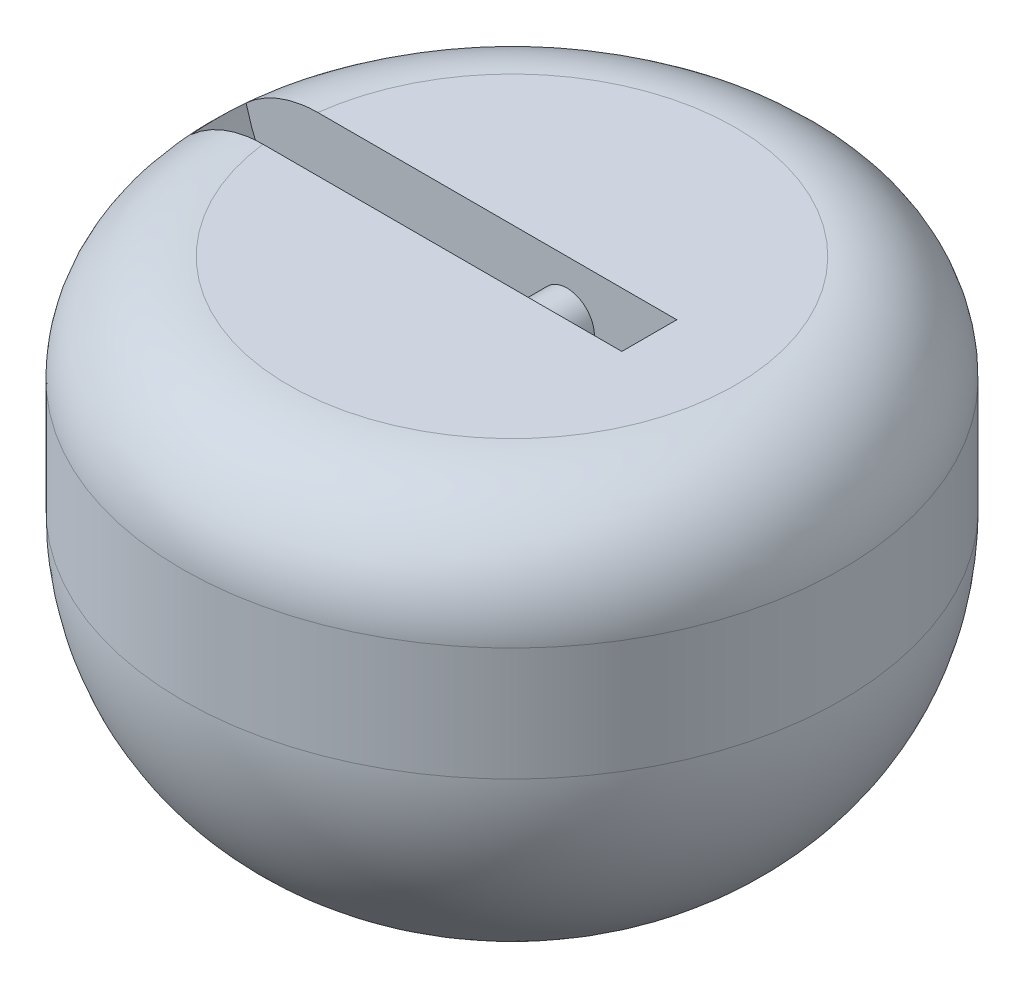
from build123d import *

# Parameters (mm, degrees)
CUT_EXTRUDE_1_DEPTH = 1
SKETCH_3_R          = 1
EXTRUDE_2_DEPTH     = 2
SCALE_1_SCALE       = 2


with BuildPart() as part:
    # 草图1 → 旋转1 (revolve)
    with BuildSketch(Plane.XY, mode=Mode.PRIVATE) as revolve_1_sk:
        with BuildLine():
            Line((0, 0), (8.130902005, 0))
            ThreePointArc((8.130902005, 0), (10.866767434, -1.133232566), (12, -3.869097995))
            Line((12, -3.869097995), (12, -8))
            ThreePointArc((12, -8), (8.313394886, -15.706083875), (0, -17.671345033))
            Line((0, -17.671345033), (0, 0))
        make_face()
    revolve(revolve_1_sk.sketch.rotate(Axis((0, -17.671345033, 0), (0, 1, 0)), 90), axis=Axis((0, -17.671345033, 0), (0, 1, 0)))

    # 草图2 → 切除-拉伸1 (cut, symmetric)
    with BuildSketch(Plane.XY):
        with BuildLine():
            Line((0, 0), (5, 0))
            ThreePointArc((5, 0), (-2.937253933, -7), (-10.874507866, 0))
            Line((-10.874507866, 0), (0, 0))
        make_face()
    extrude(amount=CUT_EXTRUDE_1_DEPTH, both=True, mode=Mode.SUBTRACT)

    # 草图3 → 凸台-拉伸2 (add)
    with BuildSketch(Plane.XY.offset(-1)):
        with Locations(Location((1, -2, 0), (0, 0, 180))):
            Circle(SKETCH_3_R)
        with Locations(Location((-3, -5, 0), (0, 0, 180))):
            Circle(SKETCH_3_R)
    extrude(amount=EXTRUDE_2_DEPTH)


with BuildPart() as part_1:
    # 缩放比例1: scaled about (0.072561916, -8.060328737, 5e-09)
    add(part.part.scale(SCALE_1_SCALE).moved(Location((-0.072561916, 8.060328737, -5e-09))))


solid = part_1.part
